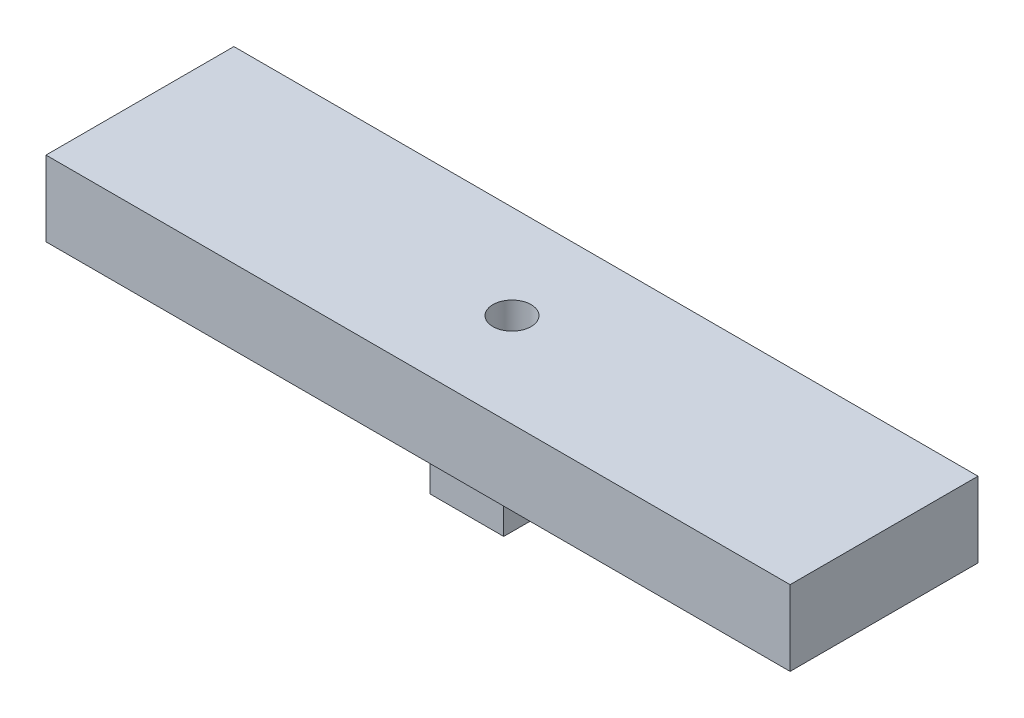
from build123d import *

# Parameters (mm, degrees)
SKETCH1_W           = 99
SKETCH1_H           = 25
BOSS_EXTRUDE1_DEPTH = 10
SKETCH9_W           = 9.8
SKETCH9_H           = 12
BOSS_EXTRUDE9_DEPTH = 10
SKETCH10_R          = 2.54
CUT_EXTRUDE1_DEPTH  = 5.22
SKETCH11_R          = 2.05
CUT_EXTRUDE2_DEPTH  = 10


with BuildPart() as part:
    # Sketch1 → Boss-Extrude1 (new body)
    with BuildSketch(Plane(origin=(0, 0, 0), x_dir=(1, 0, 0), z_dir=(0, 1, 0))):
        Rectangle(SKETCH1_W, SKETCH1_H)
    extrude(amount=BOSS_EXTRUDE1_DEPTH)

    # Sketch9 → Boss-Extrude9 (add)
    with BuildSketch(Plane.XZ):
        Rectangle(SKETCH9_W, SKETCH9_H)
    extrude(amount=BOSS_EXTRUDE9_DEPTH)

    # Sketch10 → Cut-Extrude1 (cut)
    with BuildSketch(Plane(origin=(0, 10, 0), x_dir=(1, 0, 0), z_dir=(0, 1, 0))):
        with Locations(Location((0, 0, 0), (0, 0, 270))):
            Circle(SKETCH10_R)
    extrude(amount=-CUT_EXTRUDE1_DEPTH, mode=Mode.SUBTRACT)

    # Sketch11 → Cut-Extrude2 (cut)
    with BuildSketch(Plane(origin=(4.9, 0, 0), x_dir=(0, 0, -1), z_dir=(1, 0, 0))):
        with Locations((0, -6)):
            Circle(SKETCH11_R)
    extrude(amount=-CUT_EXTRUDE2_DEPTH, mode=Mode.SUBTRACT)


solid = part.part
